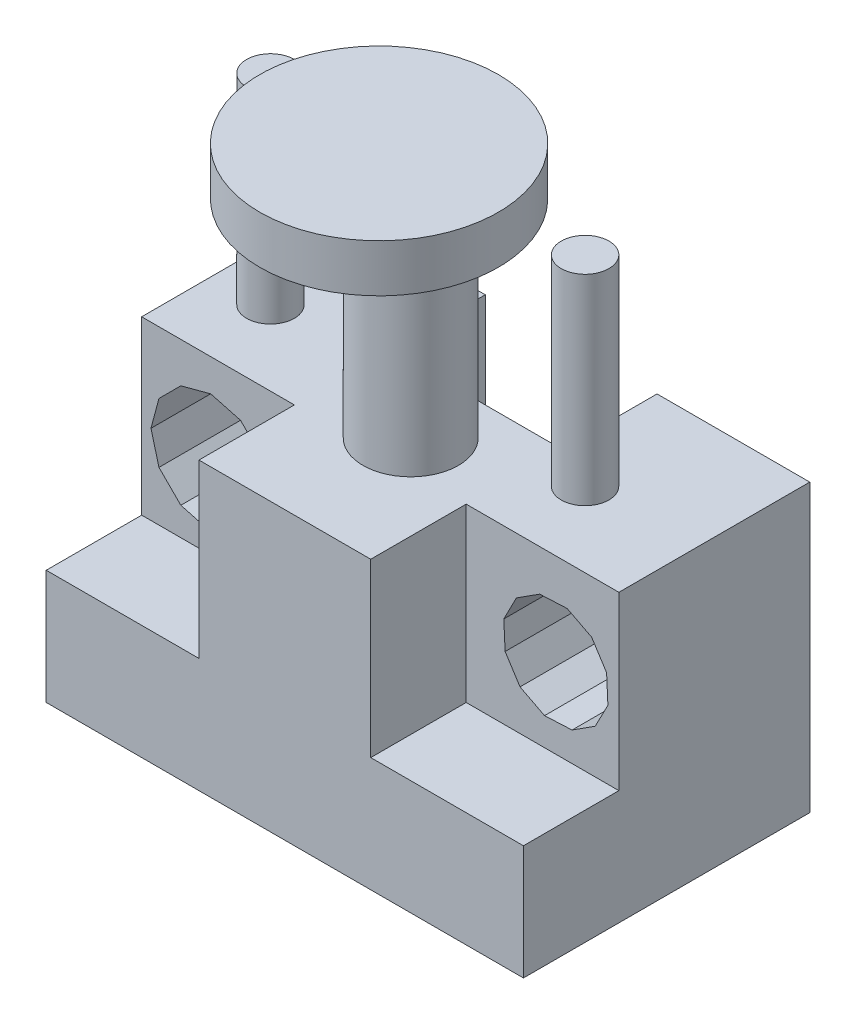
from build123d import *

# Parameters (mm, degrees)
SKETCH1_W           = 50000
SKETCH1_H           = 30000
BOSS_EXTRUDE1_DEPTH = 30000
SKETCH2_W           = 16000
SKETCH2_H           = 18000
CUT_EXTRUDE1_DEPTH  = 10000
SKETCH3_W           = 18000
SKETCH3_H           = 17072.210439065
CUT_EXTRUDE2_DEPTH  = 10000
SKETCH4_R           = 5000
BOSS_EXTRUDE2_DEPTH = 21000
SKETCH5_R           = 12500
BOSS_EXTRUDE3_DEPTH = 5000
CUT_EXTRUDE3_DEPTH  = 10000
CUT_EXTRUDE4_DEPTH  = 10000
SKETCH8_R           = 2500
BOSS_EXTRUDE4_DEPTH = 21000


with BuildPart() as part:
    # Sketch1 → Boss-Extrude1 (new body)
    with BuildSketch(Plane.XY):
        with Locations((25000, -15000)):
            Rectangle(SKETCH1_W, SKETCH1_H)
    extrude(amount=BOSS_EXTRUDE1_DEPTH)

    # Sketch2 → Cut-Extrude1 (cut)
    with BuildSketch(Plane.XY.offset(30000)):
        with Locations((8000, -9000)):
            Rectangle(SKETCH2_W, SKETCH2_H)
        with Locations((42000, -9000)):
            Rectangle(SKETCH2_W, SKETCH2_H)
    extrude(amount=-CUT_EXTRUDE1_DEPTH, mode=Mode.SUBTRACT)

    # Sketch3 → Cut-Extrude2 (cut)
    with BuildSketch(Plane(origin=(0, 0, 0), x_dir=(-1, 0, 0), z_dir=(0, 0, -1))):
        with Locations((-25000, -8536.105219533)):
            Rectangle(SKETCH3_W, SKETCH3_H)
    extrude(amount=-CUT_EXTRUDE2_DEPTH, mode=Mode.SUBTRACT)

    # Sketch4 → Boss-Extrude2 (add)
    with BuildSketch(Plane(origin=(0, 0, 0), x_dir=(1, 0, 0), z_dir=(0, 1, 0))):
        with Locations(Location((25086.342101628, -16899.52623581, 0), (0, 0, 90))):
            Circle(SKETCH4_R)
    extrude(amount=BOSS_EXTRUDE2_DEPTH)

    # Sketch5 → Boss-Extrude3 (add)
    with BuildSketch(Plane(origin=(0, 21000, 0), x_dir=(1, 0, 0), z_dir=(0, 1, 0))):
        with Locations(Location((22703.691843144, -17829.118745341, 0), (0, 0, 270))):
            Circle(SKETCH5_R)
    extrude(amount=BOSS_EXTRUDE3_DEPTH)

    # Sketch6 → Cut-Extrude3 (cut)
    with BuildSketch(Plane.XY.offset(20000)):
        Polygon((13486.636274247, -9633.860731206), (12648.322004551, -6505.22928399), (10358.004827031, -4214.912106471), (7229.373379816, -3376.597836775), (4100.7419326, -4214.912106471), (1810.424755081, -6505.22928399), (972.110485385, -9633.860731206), (1810.424755081, -12762.492178421), (4100.7419326, -15052.809355941), (7229.373379816, -15891.123625637), (10358.004827031, -15052.809355941), (12648.322004551, -12762.492178421), align=None)
    extrude(amount=-CUT_EXTRUDE3_DEPTH, mode=Mode.SUBTRACT)

    # Sketch7 → Cut-Extrude4 (cut)
    with BuildSketch(Plane.XY.offset(20000)):
        Polygon((39266.559399303, -5879.502994547), (37942.667948973, -8447.388311527), (38080.086979624, -11333.187955202), (39641.995172969, -13763.654241531), (42209.880489949, -15087.545691861), (45095.680133623, -14950.126661209), (47526.146419952, -13388.218467865), (48850.037870282, -10820.333150885), (48712.618839631, -7934.53350721), (47150.710646286, -5504.067220882), (44582.825329306, -4180.175770552), (41697.025685631, -4317.594801203), align=None)
    extrude(amount=-CUT_EXTRUDE4_DEPTH, mode=Mode.SUBTRACT)

    # Sketch8 → Boss-Extrude4 (add)
    with BuildSketch(Plane(origin=(0, 0, 0), x_dir=(1, 0, 0), z_dir=(0, 1, 0))):
        with Locations(Location((38607.22266917, -12149.542526099, 0), (0, 0, 90))):
            Circle(SKETCH8_R)
        with Locations(Location((5644.669008724, -12149.542526099, 0), (0, 0, 90))):
            Circle(SKETCH8_R)
    extrude(amount=BOSS_EXTRUDE4_DEPTH)


solid = part.part
